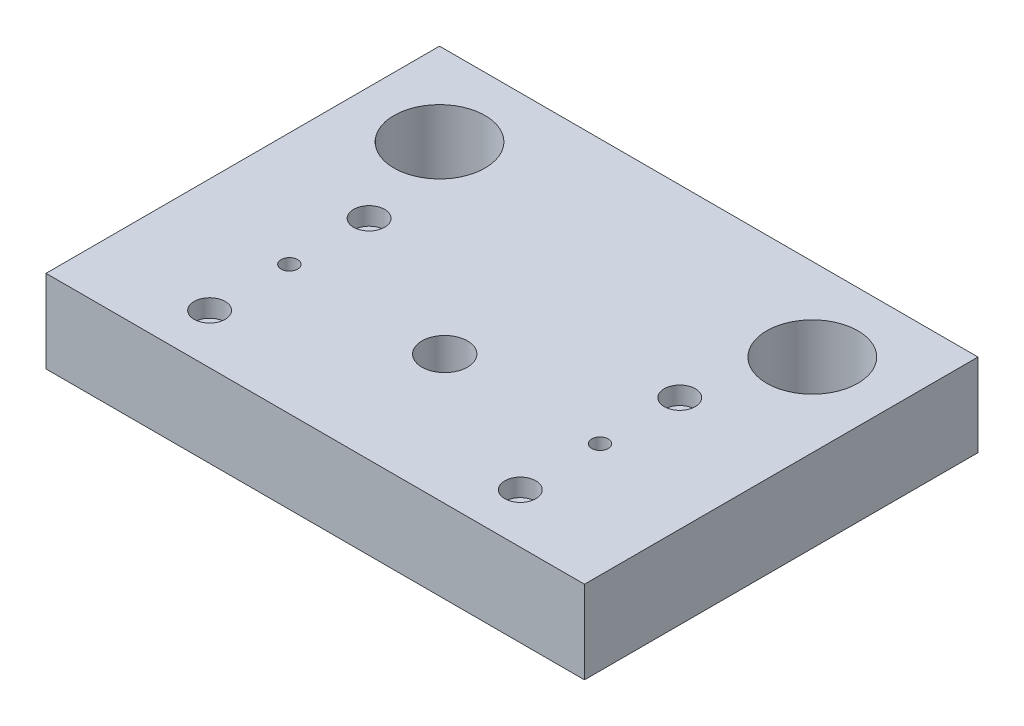
from build123d import *

# Parameters (mm, degrees)
SKETCH1_W                                           = 260
SKETCH1_H                                           = 190
BOSS_EXTRUDE1_DEPTH                                 = 40
SKETCH2_R                                           = 22
CUT_EXTRUDE1_DEPTH                                  = 166.90660023
M24X2_0_TAPPED_HOLE1_D                              = 22
SKETCH7_W                                           = 70.1
SKETCH7_H                                           = 55.1
CUT_EXTRUDE2_DEPTH                                  = 20
SKETCH8_R                                           = 5
CUT_EXTRUDE3_DEPTH                                  = 20
CBORE_FOR_M8_HEX_SOCKET_HEAD_CAP_SCREW1_D           = 8.4
CBORE_FOR_M8_HEX_SOCKET_HEAD_CAP_SCREW1_CBORE_D     = 15
CBORE_FOR_M8_HEX_SOCKET_HEAD_CAP_SCREW1_CBORE_DEPTH = 8.6
F_8_0MM_DOWEL_HOLE1_D                               = 8


with BuildPart() as part:
    # Sketch1 → Boss-Extrude1 (new body)
    with BuildSketch(Plane(origin=(0, 0, 0), x_dir=(1, 0, 0), z_dir=(0, 1, 0))):
        Rectangle(SKETCH1_W, SKETCH1_H)
    extrude(amount=-BOSS_EXTRUDE1_DEPTH)

    # Sketch2 → Cut-Extrude1 (cut, through all)
    with BuildSketch(Plane(origin=(0, 0, 0), x_dir=(1, 0, 0), z_dir=(0, 1, 0))):
        with Locations(Location((-90, 55, 0), (0, 0, 270))):
            Circle(SKETCH2_R)
        with Locations(Location((90, 55, 0), (0, 0, 270))):
            Circle(SKETCH2_R)
    extrude(amount=-CUT_EXTRUDE1_DEPTH, mode=Mode.SUBTRACT)

    # M24x2.0 Tapped Hole1 (through all)
    with Locations(Plane(origin=(0, 0, 0), x_dir=(1, 0, 0), z_dir=(0, 1, 0))):
        with Locations((0, -32.5)):
            Hole(M24X2_0_TAPPED_HOLE1_D / 2)

    # Sketch7 → Cut-Extrude2 (cut)
    with BuildSketch(Plane(origin=(0, -40, 0), x_dir=(1, 0, 0), z_dir=(0, 1, 0))):
        with Locations((0, -32.5)):
            Rectangle(SKETCH7_W, SKETCH7_H)
    extrude(amount=CUT_EXTRUDE2_DEPTH, mode=Mode.SUBTRACT)

    # Sketch8 → Cut-Extrude3 (cut)
    with BuildSketch(Plane.XZ.offset(40)):
        with Locations((-35.05, 60.05)):
            Circle(SKETCH8_R)
        with Locations((35.05, 60.05)):
            Circle(SKETCH8_R)
        with Locations((-35.05, 4.95)):
            Circle(SKETCH8_R)
        with Locations((35.05, 4.95)):
            Circle(SKETCH8_R)
    extrude(amount=-CUT_EXTRUDE3_DEPTH, mode=Mode.SUBTRACT)

    # CBORE for M8 Hex Socket Head Cap Screw1 (through all)
    with Locations(Plane(origin=(0, 0, 0), x_dir=(1, 0, 0), z_dir=(0, 1, 0))):
        with Locations((-75, -71), (-75, 6), (75, 6), (75, -71)):
            CounterBoreHole(CBORE_FOR_M8_HEX_SOCKET_HEAD_CAP_SCREW1_D / 2, CBORE_FOR_M8_HEX_SOCKET_HEAD_CAP_SCREW1_CBORE_D / 2, CBORE_FOR_M8_HEX_SOCKET_HEAD_CAP_SCREW1_CBORE_DEPTH)

    # Ø8.0mm Dowel Hole1 (through all)
    with Locations(Plane(origin=(0, 0, 0), x_dir=(1, 0, 0), z_dir=(0, 1, 0))):
        with Locations((-75, -32.5), (75, -32.5)):
            Hole(F_8_0MM_DOWEL_HOLE1_D / 2)


solid = part.part
